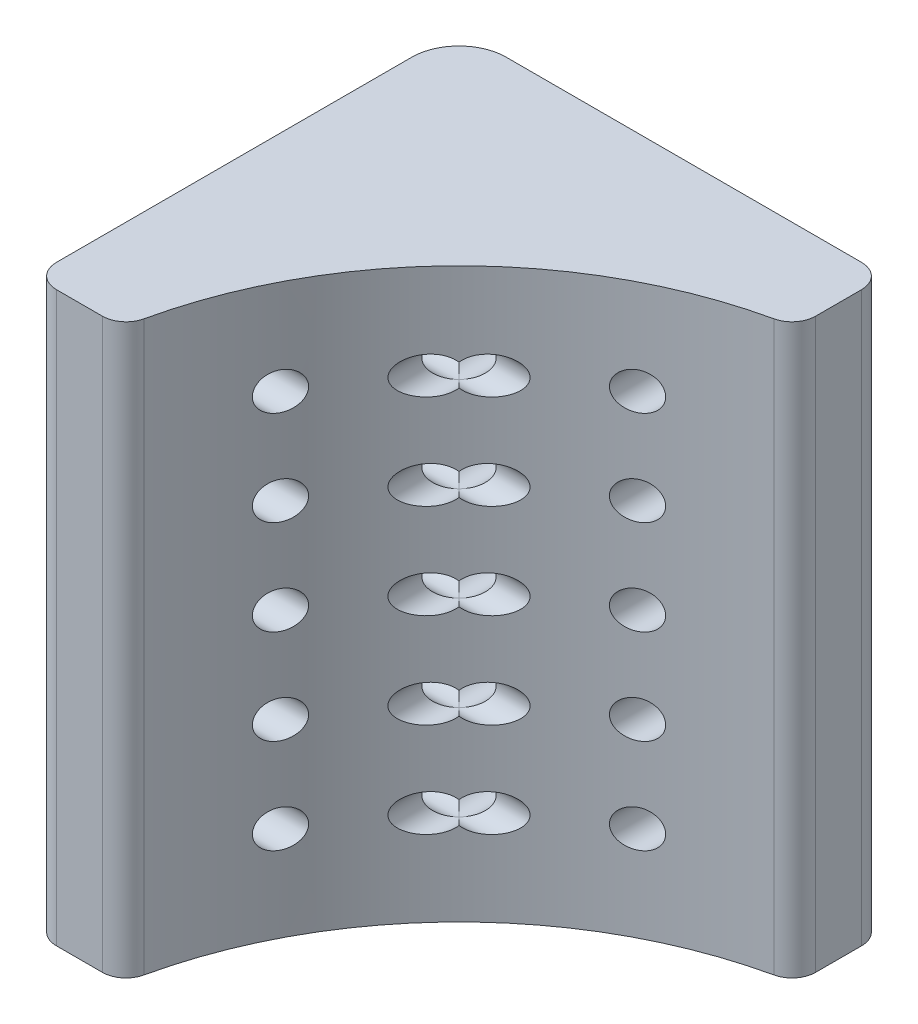
from build123d import *

# Parameters (mm, degrees)
BOSS_EXTRUDE1_DEPTH = 76.2
SKETCH3_R           = 2.4892
CUT_EXTRUDE1_DEPTH  = 76.2
SKETCH4_R           = 2.4892
CUT_EXTRUDE2_DEPTH  = 76.2


with BuildPart() as part:
    # Sketch2 → Boss-Extrude1 (new body)
    with BuildSketch(Plane(origin=(0, 0, 0), x_dir=(1, 0, 0), z_dir=(0, 1, 0))):
        with BuildLine():
            Line((53.975, 0), (6.35, 0))
            ThreePointArc((6.35, 0), (1.859871939, -1.859871939), (0, -6.35))
            Line((0, -6.35), (0, -53.975))
            ThreePointArc((0, -53.975), (0.92993597, -56.22006403), (3.175, -57.15))
            Line((3.175, -57.15), (9.326905819, -57.15))
            ThreePointArc((9.326905819, -57.15), (11.314496282, -56.450905723), (12.426802892, -54.661486078))
            ThreePointArc((12.426802892, -54.661486078), (27.386379458, -27.386379483), (54.661486043, -12.426802899))
            ThreePointArc((54.661486043, -12.426802899), (56.450905712, -11.314496296), (57.15, -9.326905819))
            Line((57.15, -9.326905819), (57.15, -3.175))
            ThreePointArc((57.15, -3.175), (56.22006403, -0.92993597), (53.975, 0))
        make_face()
    extrude(amount=BOSS_EXTRUDE1_DEPTH)

    # Sketch3 → Cut-Extrude1 (cut)
    with BuildSketch(Plane.ZY):
        with Locations((25.4, 12.7)):
            Circle(SKETCH3_R)
        with Locations((41.275, 12.7)):
            Circle(SKETCH3_R)
        with Locations((41.275, 25.4)):
            Circle(SKETCH3_R)
        with Locations((41.275, 38.1)):
            Circle(SKETCH3_R)
        with Locations((41.275, 50.8)):
            Circle(SKETCH3_R)
        with Locations((41.275, 63.5)):
            Circle(SKETCH3_R)
        with Locations((25.4, 25.4)):
            Circle(SKETCH3_R)
        with Locations((25.4, 38.1)):
            Circle(SKETCH3_R)
        with Locations((25.4, 50.8)):
            Circle(SKETCH3_R)
        with Locations((25.4, 63.5)):
            Circle(SKETCH3_R)
    extrude(amount=-CUT_EXTRUDE1_DEPTH, mode=Mode.SUBTRACT)

    # Sketch4 → Cut-Extrude2 (cut)
    with BuildSketch(Plane(origin=(0, 0, 0), x_dir=(-1, 0, 0), z_dir=(0, 0, -1))):
        with Locations((-25.4, 12.7)):
            Circle(SKETCH4_R)
        with Locations((-41.275, 12.7)):
            Circle(SKETCH4_R)
        with Locations((-41.275, 25.4)):
            Circle(SKETCH4_R)
        with Locations((-41.275, 38.1)):
            Circle(SKETCH4_R)
        with Locations((-41.275, 50.8)):
            Circle(SKETCH4_R)
        with Locations((-41.275, 63.5)):
            Circle(SKETCH4_R)
        with Locations((-25.4, 25.4)):
            Circle(SKETCH4_R)
        with Locations((-25.4, 38.1)):
            Circle(SKETCH4_R)
        with Locations((-25.4, 50.8)):
            Circle(SKETCH4_R)
        with Locations((-25.4, 63.5)):
            Circle(SKETCH4_R)
    extrude(amount=-CUT_EXTRUDE2_DEPTH, mode=Mode.SUBTRACT)


solid = part.part
